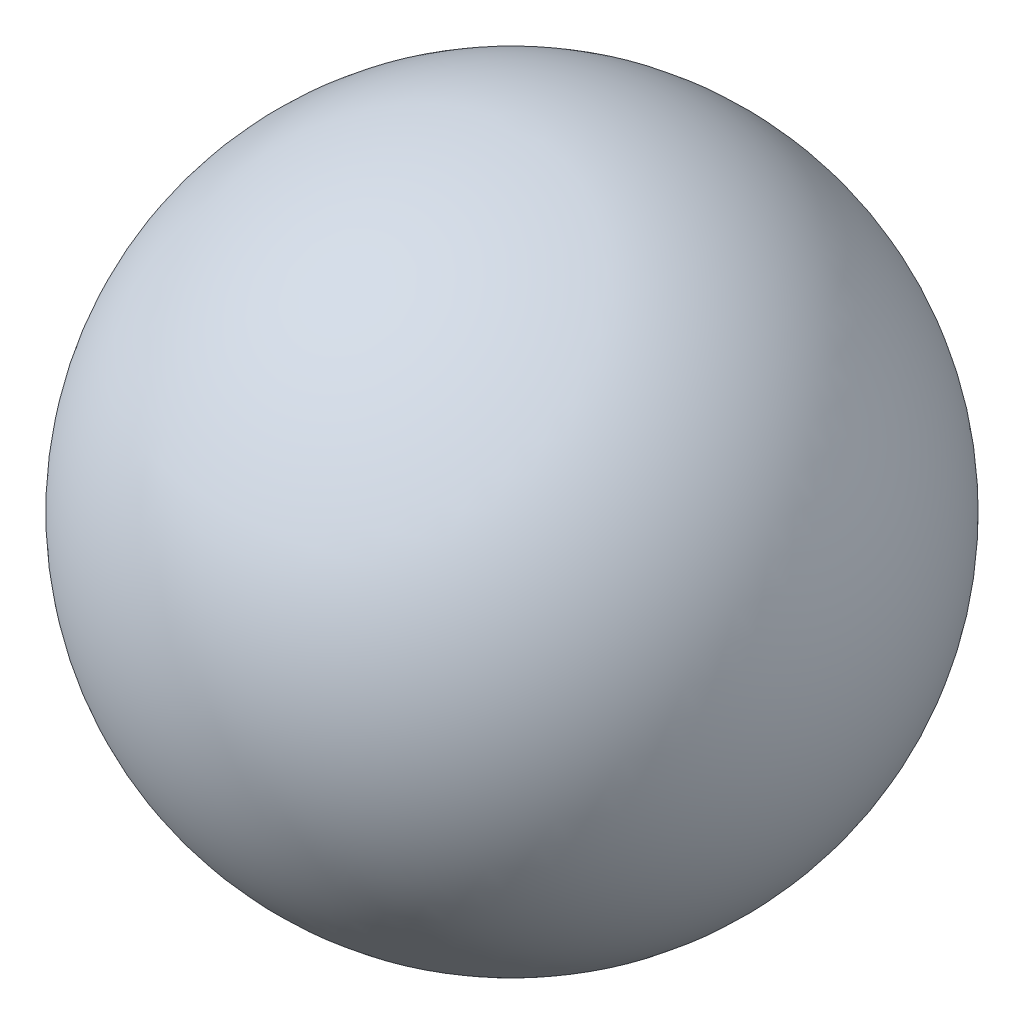
from build123d import *


with BuildPart() as part:
    # Sketch1 → Main Revolve (revolve)
    with BuildSketch(Plane.XY):
        with BuildLine():
            Line((0, -12.7), (0, 12.7))
            ThreePointArc((0, 12.7), (-12.7, 0), (0, -12.7))
        make_face()
    revolve(axis=Axis((0, -1000, 0), (0, 1, 0)))


solid = part.part
